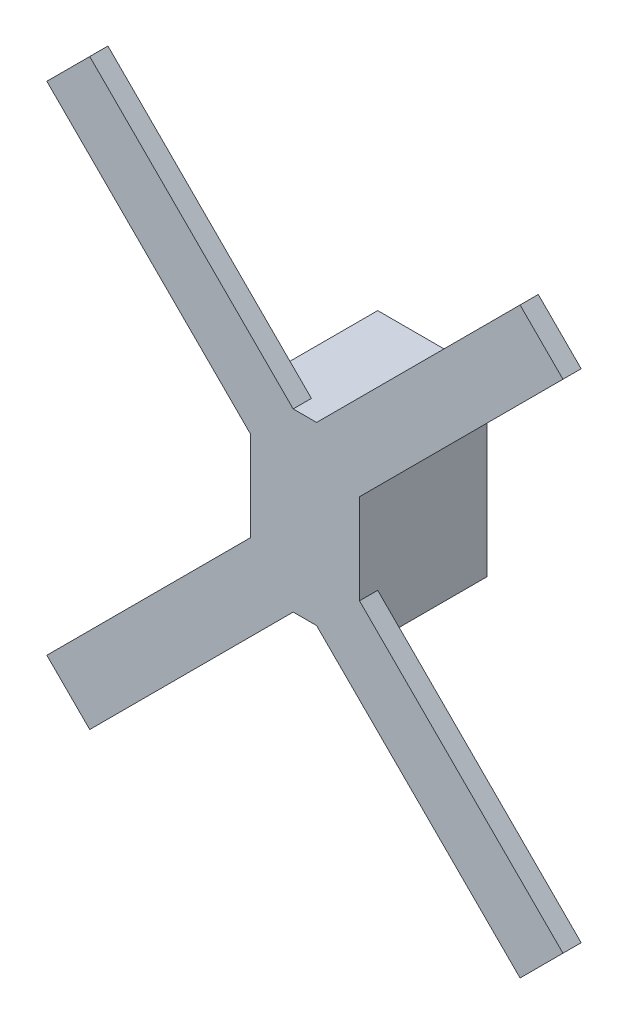
from build123d import *

# Parameters (mm, degrees)
CROQUIS1_W              = 14
CROQUIS1_H              = 25
SALIENTE_EXTRUIR3_DEPTH = 21
CROQUIS3_W              = 14
CROQUIS3_H              = 25
SALIENTE_EXTRUIR4_DEPTH = 2
SALIENTE_EXTRUIR5_DEPTH = 3


with BuildPart() as part:
    # Croquis1 → Saliente-Extruir3 (new body)
    with BuildSketch(Plane.XY):
        Polygon((-26.265270251, -2.501993068), (-26.265270251, -29.501993068), (-10.265270251, -29.501993068), (-8.265270251, -29.501993068), (-8.265270251, -27.501993068), (-8.265270251, -0.501993068), (-24.265270251, -0.501993068), (-26.265270251, -0.501993068), align=None)
        with Locations((-17.265270251, -15.001993068)):
            Rectangle(CROQUIS1_W, CROQUIS1_H, mode=Mode.SUBTRACT)
    extrude(amount=SALIENTE_EXTRUIR3_DEPTH)

    # Croquis3 → Saliente-Extruir4 (add)
    with BuildSketch(Plane.XY.offset(21)):
        with Locations((-17.265270251, -15.001993068)):
            Rectangle(CROQUIS3_W, CROQUIS3_H)
    extrude(amount=-SALIENTE_EXTRUIR4_DEPTH)

    # Croquis4 → Saliente-Extruir5 (add)
    with BuildSketch(Plane.XY.offset(21)):
        Polygon((-56.265270251, 29.498006932), (-52.729736345, 33.033540838), (-19.194202439, -0.501993068), (-26.265270251, -0.501993068), (-26.265270251, -7.573060879), (-59.800804157, 25.962473026), align=None)
        Polygon((21.734729749, 29.498006932), (25.270263655, 25.962473026), (-8.265270251, -7.573060879), (-8.265270251, -0.501993068), (-15.336338063, -0.501993068), (18.199195843, 33.033540838), align=None)
        Polygon((25.270263655, -55.966459162), (21.734729749, -59.501993068), (18.199195843, -63.037526974), (-15.336338063, -29.501993068), (-8.265270251, -29.501993068), (-8.265270251, -22.430925256), align=None)
        Polygon((-56.265270251, -59.501993068), (-59.800804157, -55.966459162), (-26.265270251, -22.430925256), (-26.265270251, -29.501993068), (-19.194202439, -29.501993068), (-52.729736345, -63.037526974), align=None)
    extrude(amount=-SALIENTE_EXTRUIR5_DEPTH)


solid = part.part
